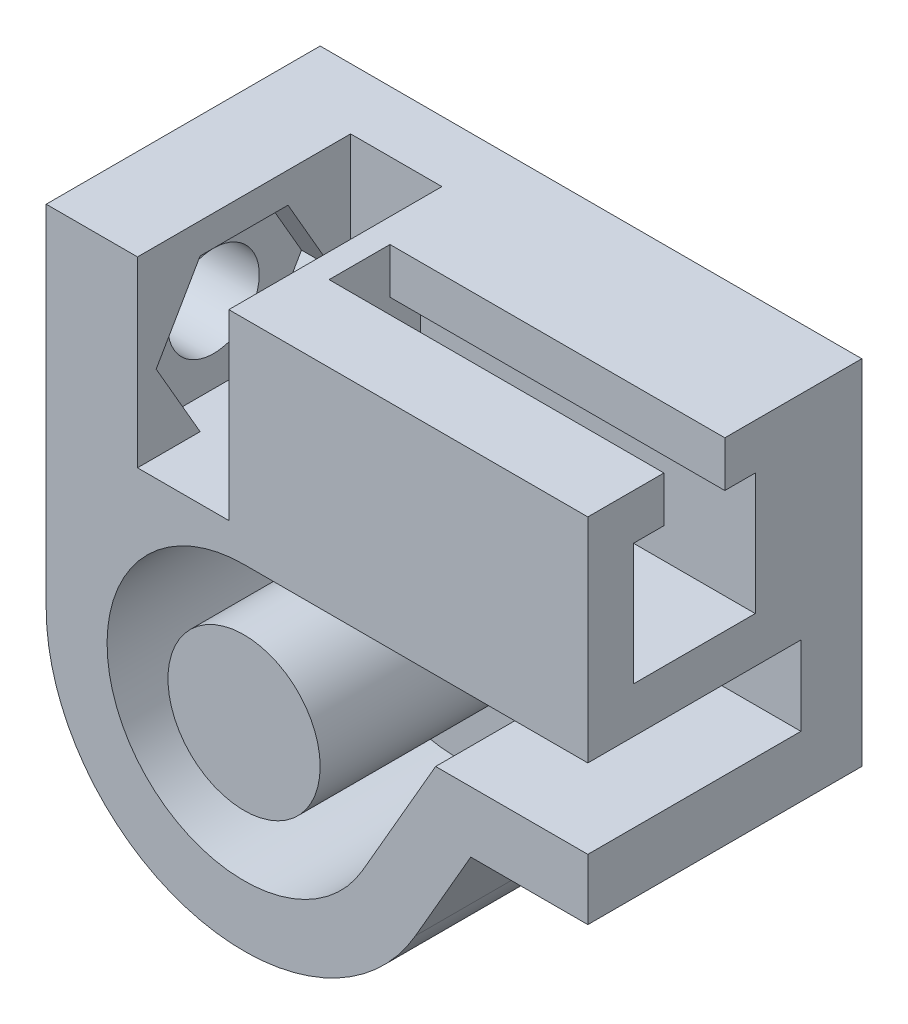
from build123d import *

# Parameters (mm, degrees)
ESBO_O1_R                  = 2.5
RESSALTO_EXTRUS_O1_DEPTH   = 7
RESSALTO_EXTRUS_O1_2_DEPTH = 7
CORTE_EXTRUS_O1_DEPTH      = 1
CORTE_EXTRUS_O2_DEPTH      = 21.752652218
CORTE_EXTRUS_O2_DEPTH_BACK = 21.752652218
ESBO_O4_R                  = 1.5
CORTE_EXTRUS_O3_DEPTH      = 11
RESSALTO_EXTRUS_O5_START   = -7
ESBO_O6_W                  = 3
ESBO_O6_H                  = 6
RESSALTO_EXTRUS_O5_DEPTH   = 2


with BuildPart() as part:
    # Esboço1 → Ressalto-extrusão1 (new body)
    with BuildSketch(Plane.XY):
        Circle(ESBO_O1_R)
    extrude(amount=RESSALTO_EXTRUS_O1_DEPTH)



with BuildPart() as body_2:
    # Esboço1 → Ressalto-extrus_o1 2 (new body)
    with BuildSketch(Plane.XY):
        with BuildLine():
            ThreePointArc((0, 4.5), (-3.897114317, -2.25), (3.897114317, -2.25))
            Line((3.897114317, -2.25), (6.293117934, 1.9))
            Line((6.293117934, 1.9), (11.293117934, 1.9))
            Line((11.293117934, 1.9), (11.293117934, -0.1))
            Line((11.293117934, -0.1), (7.447818473, -0.1))
            Line((7.447818473, -0.1), (5.629165125, -3.25))
            ThreePointArc((5.629165125, -3.25), (-1.682323793, -6.278517871), (-6.5, 0))
            Line((-6.5, 0), (-6.5, 11.5))
            Line((-6.5, 11.5), (-3.5, 11.5))
            Line((-3.5, 11.5), (-3.5, 5.5))
            Line((-3.5, 5.5), (-0.5, 5.5))
            Line((-0.5, 5.5), (-0.5, 11.5))
            Line((-0.5, 11.5), (11.293117934, 11.5))
            Line((11.293117934, 11.5), (11.293117934, 6.5))
            Line((11.293117934, 6.5), (11.293117934, 4.5))
            Line((11.293117934, 4.5), (0, 4.5))
        make_face()
    extrude(amount=RESSALTO_EXTRUS_O1_2_DEPTH)

    # Esboço2 → Corte-extrusão1 (cut)
    with BuildSketch(Plane(origin=(-3.5, 0, 0), x_dir=(0, 0, -1), z_dir=(1, 0, 0))):
        Polygon((-0.613248654, 8), (-2.056624327, 10.5), (-4.943375673, 10.5), (-6.386751346, 8), (-4.943375673, 5.5), (-2.056624327, 5.5), align=None)
    extrude(amount=-CORTE_EXTRUS_O1_DEPTH, mode=Mode.SUBTRACT)

    # Esboço4 → Corte-extrusão2 (cut, two sides: drawn at the far end of the back side and taken through both)
    with BuildSketch(Plane(origin=(-4.5, 0, 0), x_dir=(0, 0, -1), z_dir=(1, 0, 0)).offset(-CORTE_EXTRUS_O2_DEPTH_BACK)):
        with Locations(Location((-3.5, 8, 0), (0, 0, 90))):
            Circle(ESBO_O4_R)
    extrude(amount=CORTE_EXTRUS_O2_DEPTH + CORTE_EXTRUS_O2_DEPTH_BACK, mode=Mode.SUBTRACT)

    # Esboço5 → Corte-extrusão3 (cut)
    with BuildSketch(Plane(origin=(11.293117934, 0, 0), x_dir=(0, 0, -1), z_dir=(1, 0, 0))):
        Polygon((-5.5, 10), (-4.5, 10), (-4.5, 11.5), (-2.5, 11.5), (-2.5, 10), (-1.5, 10), (-1.5, 6), (-5.5, 6), align=None)
    extrude(amount=-CORTE_EXTRUS_O3_DEPTH, mode=Mode.SUBTRACT)


with BuildPart() as part_1:
    add(part.part)

    add(body_2.part)  # Ressalto-extrusão5 merges body 2
    # Esboço6 → Ressalto-extrusão5 (add)
    with BuildSketch(Plane.XY.offset(7).offset(RESSALTO_EXTRUS_O5_START)):
        with BuildLine():
            Line((11.293117934, 1.9), (11.293117934, 4.5))
            Line((11.293117934, 4.5), (0, 4.5))
            ThreePointArc((0, 4.5), (-3.897114317, -2.25), (3.897114317, -2.25))
            Line((3.897114317, -2.25), (6.293117934, 1.9))
            Line((6.293117934, 1.9), (11.293117934, 1.9))
        make_face()
        with BuildLine():
            ThreePointArc((3.897114317, -2.25), (-3.897114317, -2.25), (0, 4.5))
            Line((0, 4.5), (11.293117934, 4.5))
            Line((11.293117934, 4.5), (11.293117934, 11.5))
            Line((11.293117934, 11.5), (-0.5, 11.5))
            Line((-0.5, 11.5), (-0.5, 5.5))
            Line((-0.5, 5.5), (-3.5, 5.5))
            Line((-3.5, 5.5), (-3.5, 11.5))
            Line((-3.5, 11.5), (-6.5, 11.5))
            Line((-6.5, 11.5), (-6.5, 0))
            ThreePointArc((-6.5, 0), (-1.682323793, -6.278517871), (5.629165125, -3.25))
            Line((5.629165125, -3.25), (7.447818473, -0.1))
            Line((7.447818473, -0.1), (11.293117934, -0.1))
            Line((11.293117934, -0.1), (11.293117934, 1.9))
            Line((11.293117934, 1.9), (6.293117934, 1.9))
            Line((6.293117934, 1.9), (3.897114317, -2.25))
        make_face()
        with Locations((-2, 8.5)):
            Rectangle(ESBO_O6_W, ESBO_O6_H)
    extrude(amount=-RESSALTO_EXTRUS_O5_DEPTH)


solid = part_1.part
